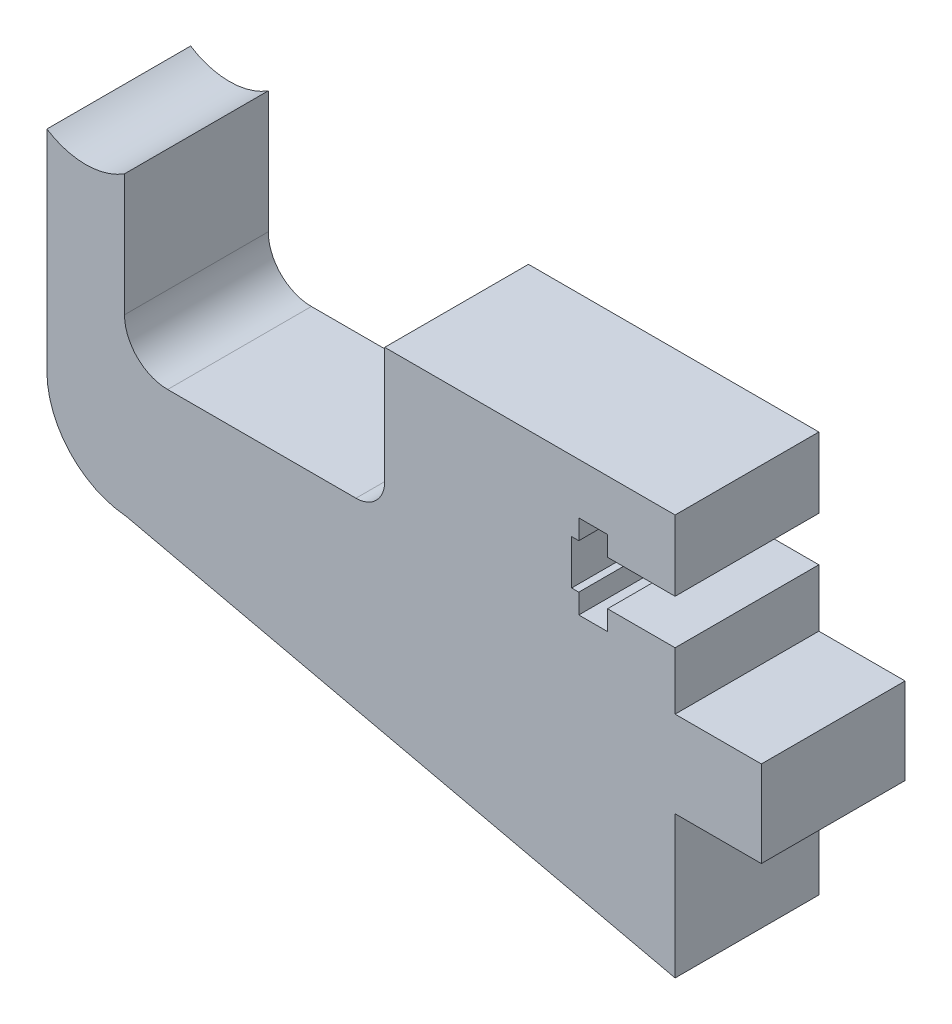
from build123d import *

# Parameters (mm, degrees)
DODANIE_WYCI_GNI_CIE1_DEPTH = 10


with BuildPart() as part:
    # Szkic1 → Dodanie-wyciągnięcie1 (new body)
    with BuildSketch(Plane.XY):
        with BuildLine():
            Line((-327.852783983, -473.3081849), (-327.852783983, -478.408833405))
            Line((-327.852783983, -478.408833405), (-327.852783983, -479.408833405))
            ThreePointArc((-327.852783983, -479.408833405), (-326.974104327, -481.530153749), (-324.852783983, -482.408833405))
            Line((-324.852783983, -482.408833405), (-320.102783983, -482.408833405))
            Line((-320.102783983, -482.408833405), (-311.752783983, -482.408833405))
            ThreePointArc((-311.752783983, -482.408833405), (-310.338570421, -481.823046968), (-309.752783983, -480.408833405))
            Line((-309.752783983, -480.408833405), (-309.752783983, -472.318864182))
            Line((-309.752783983, -472.318864182), (-300.552783983, -472.318864182))
            Line((-300.552783983, -472.318864182), (-289.552783983, -472.318864182))
            Line((-289.552783983, -472.318864182), (-289.552783983, -477.218864182))
            Line((-289.552783983, -477.218864182), (-294.252783983, -477.218864182))
            Line((-294.252783983, -477.218864182), (-294.252783983, -475.843864182))
            Line((-294.252783983, -475.843864182), (-296.252783983, -475.843864182))
            Line((-296.252783983, -475.843864182), (-296.252783983, -477.218864182))
            Line((-296.252783983, -477.218864182), (-296.752783983, -477.218864182))
            Line((-296.752783983, -477.218864182), (-296.752783983, -480.318864182))
            Line((-296.752783983, -480.318864182), (-296.252783983, -480.318864182))
            Line((-296.252783983, -480.318864182), (-296.252783983, -481.693864182))
            Line((-296.252783983, -481.693864182), (-294.252783983, -481.693864182))
            Line((-294.252783983, -481.693864182), (-294.252783983, -480.318864182))
            Line((-294.252783983, -480.318864182), (-289.552783983, -480.318864182))
            Line((-289.552783983, -480.318864182), (-289.552783983, -484.318864182))
            Line((-289.552783983, -484.318864182), (-283.552783983, -484.318864182))
            Line((-283.552783983, -484.318864182), (-283.552783983, -490.318864182))
            Line((-283.552783983, -490.318864182), (-289.552783983, -490.318864182))
            Line((-289.552783983, -490.318864182), (-289.552783983, -494.315935469))
            Line((-289.552783983, -494.315935469), (-289.552783983, -500.21329504))
            Line((-289.552783983, -500.21329504), (-327.723397777, -491.496448064))
            ThreePointArc((-327.723397777, -491.496448064), (-331.658671111, -489.587789306), (-333.252783983, -485.514932984))
            Line((-333.252783983, -485.514932984), (-333.252783983, -470.917158488))
            ThreePointArc((-333.252783983, -470.917158488), (-330.552783983, -471.708833405), (-327.852783983, -470.917158488))
            Line((-327.852783983, -470.917158488), (-327.852783983, -473.3081849))
        make_face()
    extrude(amount=DODANIE_WYCI_GNI_CIE1_DEPTH)


solid = part.part
